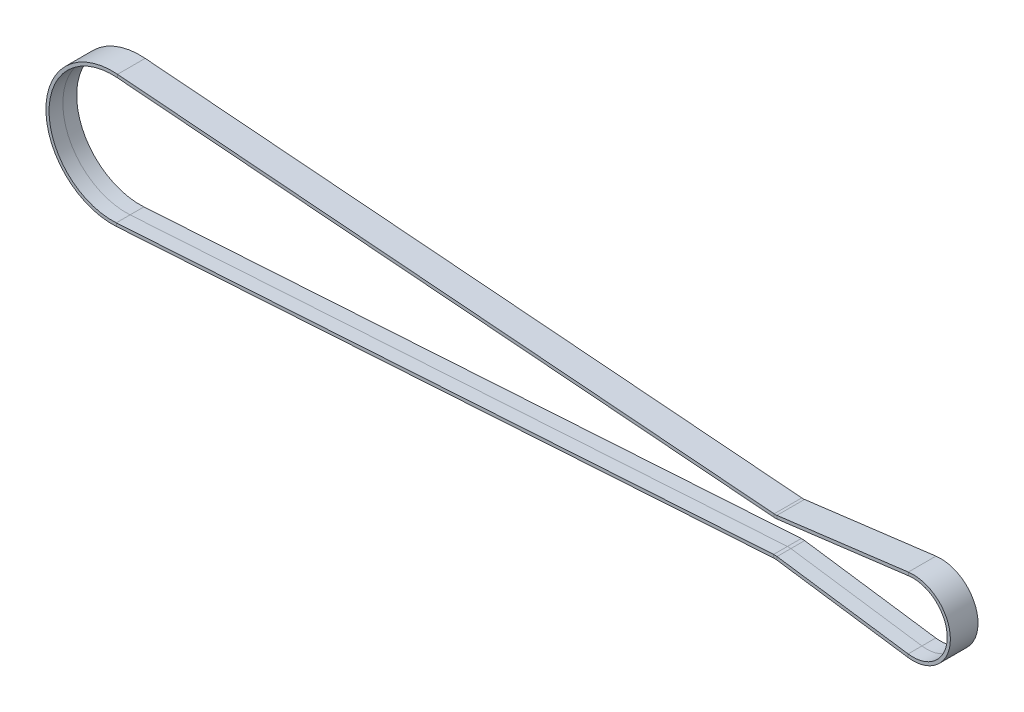
from build123d import *


with BuildPart() as part:
    # Sweep1: sweep along a path in Sketch2
    with BuildLine(Plane.XY) as sweep1_path:
        Line((0.760799283, -6.022132882), (48.345774261, -0.010539388))
        ThreePointArc((48.345774261, -0.010539388), (62.299537257, -12.415218786), (48.142681566, -24.587605966))
        Line((48.142681566, -24.587605966), (0.663551745, -17.790449832))
        ThreePointArc((0.663551745, -17.790449832), (0.04348261, -17.733939776), (-0.579113336, -17.741247775))
        Line((-0.579113336, -17.741247775), (-238.647292697, -32.77092096))
        ThreePointArc((-238.647292697, -32.77092096), (-262.989356674, -9.727192609), (-238.269798997, 12.91111482))
        Line((-238.269798997, 12.91111482), (-0.482509205, -6.050792086))
        ThreePointArc((-0.482509205, -6.050792086), (0.139880947, -6.068388033), (0.760799283, -6.022132882))
    # Sketch3 → Sweep1 (sweep)
    with BuildSketch(Plane(origin=(-238.269798997, 12.91111482, 0), x_dir=(0, 0, 1), z_dir=(-0.9968355989946425, 0.07949080812894212, 0))):
        Polygon((0, 0), (5, 0), (5, 1.14), (-5, 1.14), (-5, 0), align=None)
    sweep(path=sweep1_path.line)


solid = part.part
